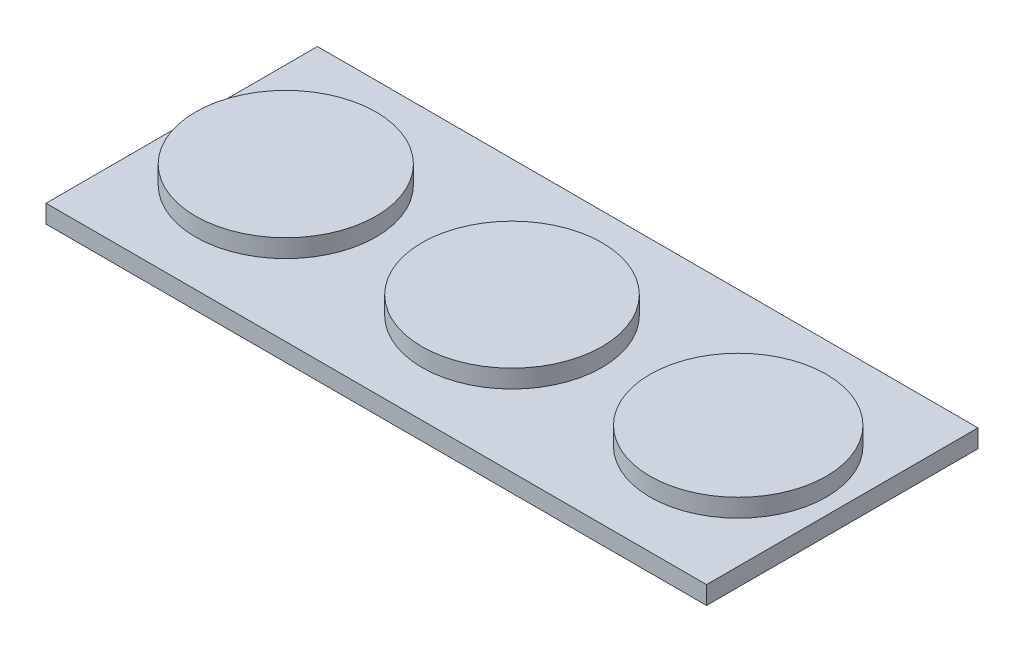
from build123d import *

# Parameters (mm, degrees)
CROQUIS1_W              = 73
CROQUIS1_H              = 30
SALIENTE_EXTRUIR1_DEPTH = 2
CROQUIS2_R              = 9.975
CROQUIS2_R_2            = 9.95
CROQUIS2_R_3            = 9.75
SALIENTE_EXTRUIR2_DEPTH = 2


with BuildPart() as part:
    # Croquis1 → Saliente-Extruir1 (new body)
    with BuildSketch(Plane(origin=(0, 0, 0), x_dir=(1, 0, 0), z_dir=(0, 1, 0))):
        Rectangle(CROQUIS1_W, CROQUIS1_H)
    extrude(amount=SALIENTE_EXTRUIR1_DEPTH)

    # Croquis2 → Saliente-Extruir2 (add)
    with BuildSketch(Plane(origin=(0, 2, 0), x_dir=(1, 0, 0), z_dir=(0, 1, 0))):
        with Locations(Location((-25, 0, 0), (0, 0, 90))):
            Circle(CROQUIS2_R)
        with Locations(Location((0, 0, 0), (0, 0, 90))):
            Circle(CROQUIS2_R_2)
        with Locations(Location((25, 0, 0), (0, 0, 90))):
            Circle(CROQUIS2_R_3)
    extrude(amount=SALIENTE_EXTRUIR2_DEPTH)


solid = part.part
